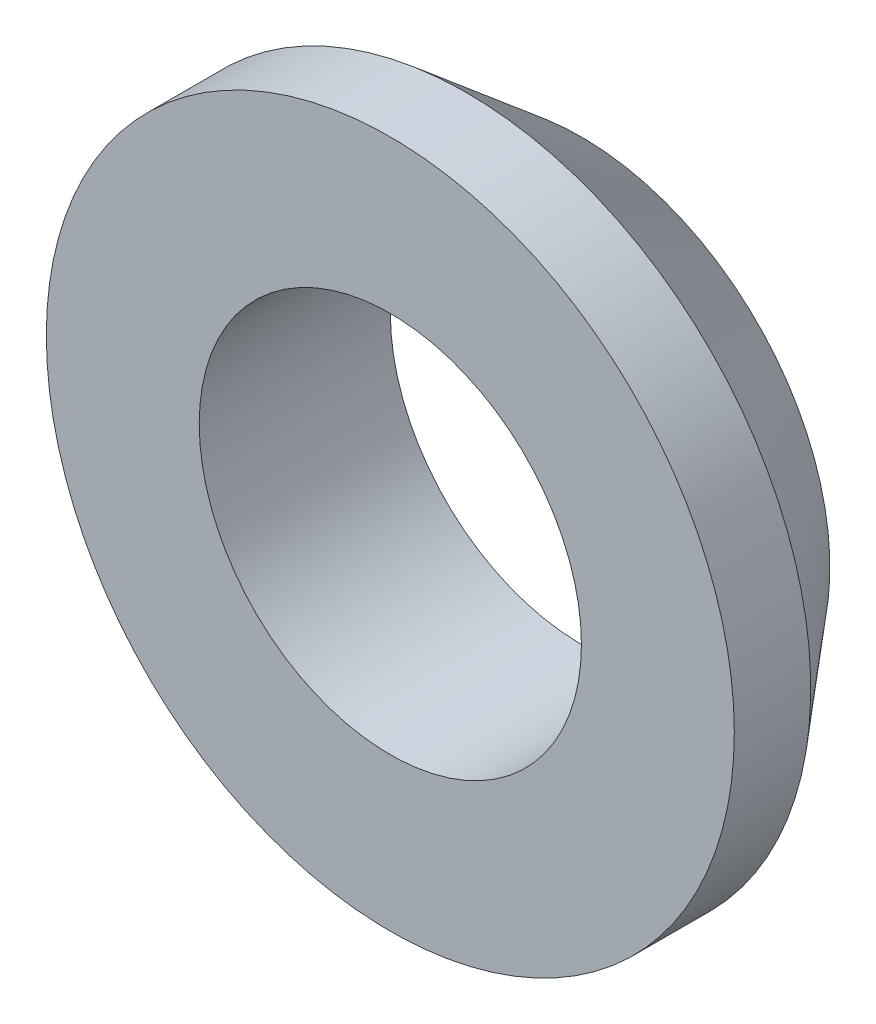
from build123d import *
from build123d.topology import SkipClean

# Parameters (mm, degrees)
SKETCH1_R           = 9
SKETCH1_R_2         = 5
BOSS_EXTRUDE1_DEPTH = 2
SKETCH3_R           = 9
SKETCH2_R           = 6.5
SKETCH4_R           = 5
CUT_EXTRUDE1_DEPTH  = 5


with BuildPart() as part:
    # Sketch1 → Boss-Extrude1 (new body)
    with BuildSketch(Plane.XY):
        Circle(SKETCH1_R)
        Circle(SKETCH1_R_2, mode=Mode.SUBTRACT)
    extrude(amount=BOSS_EXTRUDE1_DEPTH)

    # Sketch3 → Loft1 section 0
    with BuildSketch(Plane(origin=(0, 0, 0), x_dir=(-1, 0, 0), z_dir=(0, 0, -1))):
        Circle(SKETCH3_R)
    # Sketch2 → Loft1 section 1
    with BuildSketch(Plane(origin=(0, 0, -3), x_dir=(-1, 0, 0), z_dir=(0, 0, -1))):
        Circle(SKETCH2_R)
    loft()

    # Sketch4 → Cut-Extrude1 (cut)
    with SkipClean():  # the faces are left unmerged after this step: merging them gives an invalid solid
        with BuildSketch(Plane(origin=(0, 0, -3), x_dir=(-1, 0, 0), z_dir=(0, 0, -1))):
            Circle(SKETCH4_R)
        extrude(amount=-CUT_EXTRUDE1_DEPTH, mode=Mode.SUBTRACT)


solid = part.part
